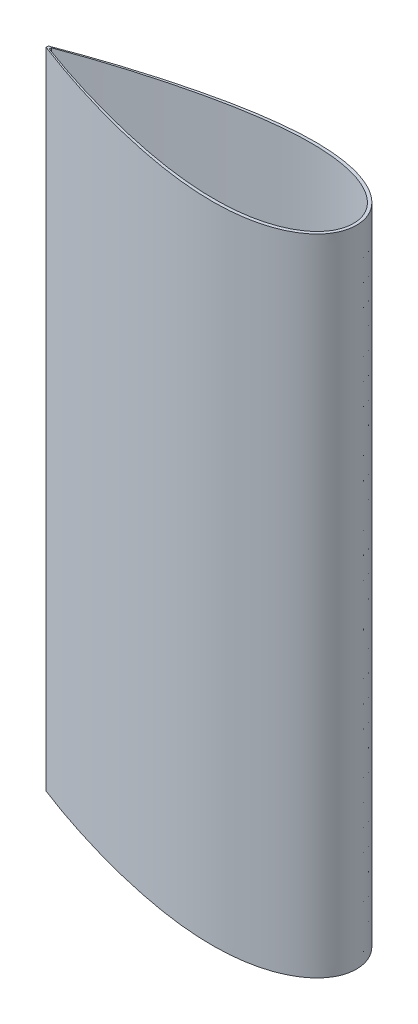
from build123d import *

# Parameters (mm, degrees)
BOSS_EXTRUDE1_DEPTH     = 170
CUT_EXTRUDE1_DEPTH      = 180.854833108
CUT_EXTRUDE1_DEPTH_BACK = 180.854833108


with BuildPart() as part:
    # Sketch1 → Boss-Extrude1 (new body)
    with BuildSketch(Plane(origin=(0, 0, 0), x_dir=(1, 0, 0), z_dir=(0, 1, 0))):
        with BuildLine():
            Line((-57.12, 0.2856), (-57.12, -0.2856))
            add(Edge.make_bspline(
                [(-57.12, 0.2856), (-57.045504045, 0.314604206), (-56.748532371, 0.430226961), (-56.083437086, 0.687194927), (-54.983020345, 1.106877465), (-53.459184566, 1.676691002), (-51.52855133, 2.380510485), (-49.212178597, 3.199313325), (-46.535401215, 4.112246622), (-43.527539776, 5.097322401), (-40.221582128, 6.131901973), (-36.653803913, 7.192834466), (-32.863347618, 8.256320051), (-28.89176377, 9.297594062), (-24.78252437, 10.290592571), (-20.580517912, 11.207774779), (-16.331536898, 12.020262473), (-12.08176934, 12.698405987), (-7.877305137, 13.212810539), (-3.763665203, 13.535768925), (0.214645027, 13.642961665), (4.014565766, 13.515216702), (7.594915985, 13.140076298), (10.916855264, 12.512902153), (13.944388679, 11.637260037), (16.644881453, 10.524372958), (18.989439212, 9.191521805), (20.952839934, 7.659530572), (22.512519543, 5.949877808), (23.646656714, 4.08331643), (24.333371985, 2.08091679), (24.55341148, 0), (24.333371985, -2.08091679), (23.646656714, -4.08331643), (22.512519543, -5.949877808), (20.952839934, -7.659530572), (18.989439212, -9.191521805), (16.644881453, -10.524372958), (13.944388679, -11.637260037), (10.916855264, -12.512902153), (7.594915985, -13.140076298), (4.014565766, -13.515216702), (0.214645027, -13.642961665), (-3.763665203, -13.535768925), (-7.877305137, -13.212810539), (-12.08176934, -12.698405987), (-16.331536898, -12.020262473), (-20.580517912, -11.207774779), (-24.78252437, -10.290592571), (-28.89176377, -9.297594062), (-32.863347618, -8.256320051), (-36.653803913, -7.192834466), (-40.221582128, -6.131901973), (-43.527539776, -5.097322401), (-46.535401215, -4.112246622), (-49.212178597, -3.199313325), (-51.52855133, -2.380510485), (-53.459184566, -1.676691002), (-54.983020345, -1.106877465), (-56.083437086, -0.687194927), (-56.748532371, -0.430226961), (-57.045504045, -0.314604206), (-57.12, -0.2856)],
                knots=[0, 0, 0, 0, 0.001335503, 0.005323868, 0.011911305, 0.02101021, 0.032501881, 0.046239719, 0.062052502, 0.079747433, 0.099112782, 0.119920173, 0.1419267, 0.164877176, 0.188506894, 0.212545247, 0.236720465, 0.26076557, 0.284425373, 0.307464061, 0.329672653, 0.35087548, 0.370934916, 0.38975407, 0.407277889, 0.423494169, 0.438436954, 0.452195212, 0.464928581, 0.476887757, 0.488428514, 0.5, 0.511571486, 0.523112243, 0.535071419, 0.547804788, 0.561563046, 0.576505831, 0.592722111, 0.61024593, 0.629065084, 0.64912452, 0.670327347, 0.692535939, 0.715574627, 0.73923443, 0.763279535, 0.787454753, 0.811493106, 0.835122824, 0.8580733, 0.880079827, 0.900887218, 0.920252567, 0.937947498, 0.953760281, 0.967498119, 0.97898979, 0.988088695, 0.994676132, 0.998664497, 1, 1, 1, 1], degree=3))
        make_face()
    extrude(amount=BOSS_EXTRUDE1_DEPTH)

    # Sketch2 → Cut-Extrude1 (cut, two sides: drawn at the far end of the back side and taken through both)
    with BuildSketch(Plane(origin=(0, 0, 0), x_dir=(1, 0, 0), z_dir=(0, 1, 0)).offset(-CUT_EXTRUDE1_DEPTH_BACK)):
        with BuildLine():
            Line((-56.32, 0.2688), (-56.32, -0.2688))
            add(Edge.make_bspline(
                [(-56.32, 0.2688), (-56.246964327, 0.296098233), (-55.955800717, 0.404925219), (-55.303710206, 0.646790768), (-54.22481147, 1.041807165), (-52.730784194, 1.578126428), (-50.837929542, 2.240569543), (-48.566899677, 3.011230004), (-45.942536526, 3.870480147), (-42.993587092, 4.797625005), (-39.752390893, 5.771358103), (-36.254509088, 6.769891237), (-32.538313425, 7.7708251), (-28.644538635, 8.750851362), (-24.615807826, 9.685437472), (-20.496139759, 10.548659503), (-16.330448299, 11.313334133), (-12.164044756, 11.951553142), (-8.042153063, 12.435652539), (-4.009444683, 12.739565466), (-0.109594078, 12.840427415), (3.615153305, 12.72023663), (7.124418478, 12.367330009), (10.380155078, 11.777419309), (13.34715698, 10.95394257), (15.993578076, 9.907529168), (18.29133054, 8.65444961), (20.21604872, 7.214144931), (21.746035774, 5.606300031), (22.860005573, 3.849419877), (23.535542952, 1.962380003), (23.752183398, 0), (23.535542952, -1.962380003), (22.860005573, -3.849419877), (21.746035774, -5.606300031), (20.21604872, -7.214144931), (18.29133054, -8.65444961), (15.993578076, -9.907529168), (13.34715698, -10.95394257), (10.380155078, -11.777419309), (7.124418478, -12.367330009), (3.615153305, -12.72023663), (-0.109594078, -12.840427415), (-4.009444683, -12.739565466), (-8.042153063, -12.435652539), (-12.164044756, -11.951553142), (-16.330448299, -11.313334133), (-20.496139759, -10.548659503), (-24.615807826, -9.685437472), (-28.644538635, -8.750851362), (-32.538313425, -7.7708251), (-36.254509088, -6.769891237), (-39.752390893, -5.771358103), (-42.993587092, -4.797625005), (-45.942536526, -3.870480147), (-48.566899677, -3.011230004), (-50.837929542, -2.240569543), (-52.730784194, -1.578126428), (-54.22481147, -1.041807165), (-55.303710206, -0.646790768), (-55.955800717, -0.404925219), (-56.246964327, -0.296098233), (-56.32, -0.2688)],
                knots=[0, 0, 0, 0, 0.001336117, 0.005326556, 0.011918196, 0.021024447, 0.032527838, 0.046283073, 0.062120187, 0.079847486, 0.09925415, 0.120112509, 0.142180173, 0.165202311, 0.188914406, 0.213045822, 0.237324417, 0.26148228, 0.285262439, 0.308426097, 0.330759759, 0.352081437, 0.372245301, 0.391144495, 0.408712655, 0.424925603, 0.439805693, 0.453431792, 0.46595701, 0.477632115, 0.488823045, 0.5, 0.511176955, 0.522367885, 0.53404299, 0.546568208, 0.560194307, 0.575074397, 0.591287345, 0.608855505, 0.627754699, 0.647918563, 0.669240241, 0.691573903, 0.714737561, 0.73851772, 0.762675583, 0.786954178, 0.811085594, 0.834797689, 0.857819827, 0.879887491, 0.90074585, 0.920152514, 0.937879813, 0.953716927, 0.967472162, 0.978975553, 0.988081804, 0.994673444, 0.998663883, 1, 1, 1, 1], degree=3))
        make_face()
    extrude(amount=CUT_EXTRUDE1_DEPTH + CUT_EXTRUDE1_DEPTH_BACK, mode=Mode.SUBTRACT)


solid = part.part
